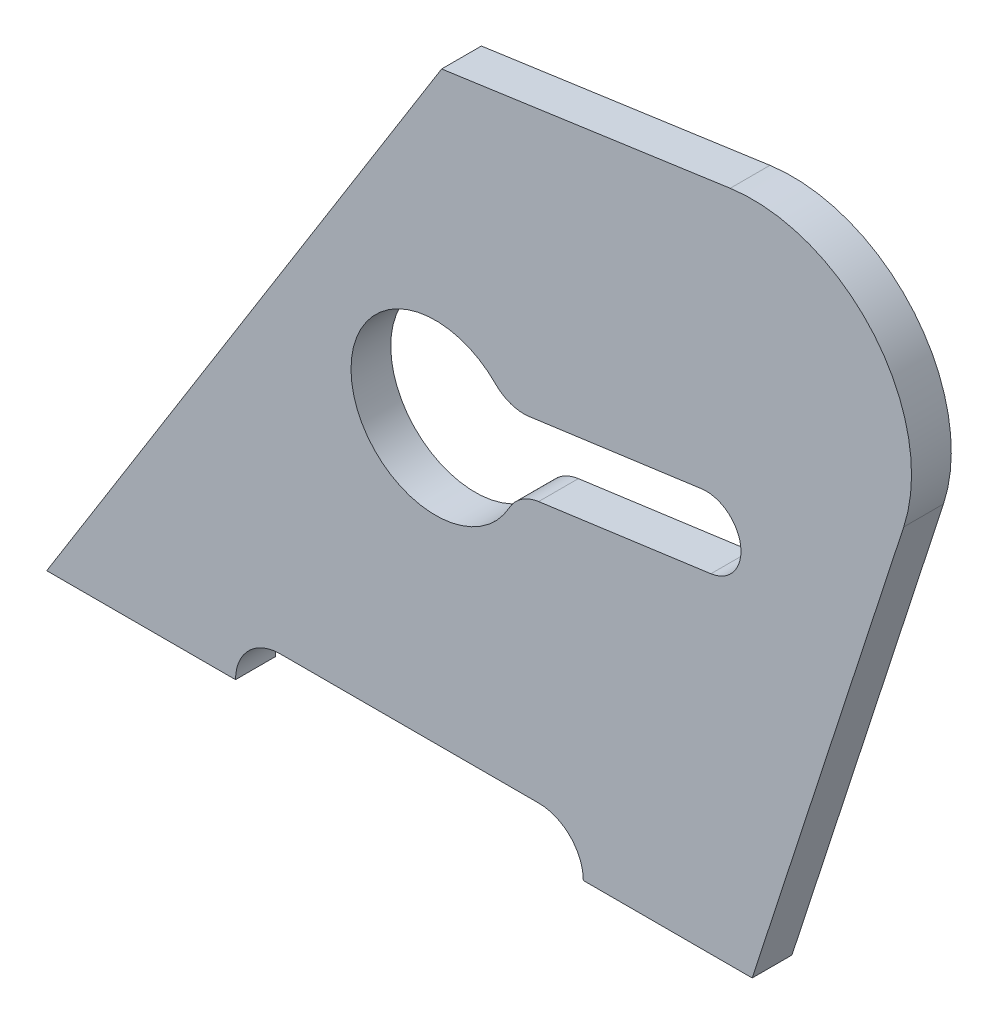
from build123d import *

# Parameters (mm, degrees)
BOSS_EXTRUDE1_DEPTH = 8


with BuildPart() as part:
    # Sketch1 → Boss-Extrude1 (new body)
    with BuildSketch(Plane.XY):
        with BuildLine():
            Line((0, 0), (79.487889635, 127.207214423))
            Line((79.487889635, 127.207214423), (137.573015724, 135.451290736))
            ThreePointArc((137.573015724, 135.451290736), (166.569139078, 124.354715336), (172.50354814, 93.880267937))
            Line((172.50354814, 93.880267937), (142, 0))
            Line((142, 0), (108, 0))
            ThreePointArc((108, 0), (105.363961031, 6.363961031), (99, 9))
            Line((99, 9), (47, 9))
            ThreePointArc((47, 9), (40.636038969, 6.363961031), (38, 0))
            Line((38, 0), (0, 0))
        make_face()
        with BuildLine():
            Line((131.785075785, 80.179945877), (97.109133521, 75.428206388))
            ThreePointArc((97.109133521, 75.428206388), (93.449886138, 75.779245046), (90.33394504, 77.729688746))
            ThreePointArc((90.33394504, 77.729688746), (61.402056741, 63.469750476), (93.103530342, 57.518568112))
            ThreePointArc((93.103530342, 57.518568112), (95.579909698, 60.235342824), (99.009829317, 61.557829483))
            Line((99.009829317, 61.557829483), (133.68577158, 66.309568971))
            ThreePointArc((133.68577158, 66.309568971), (139.670612135, 74.195105322), (131.785075785, 80.179945877))
        make_face(mode=Mode.SUBTRACT)
    extrude(amount=BOSS_EXTRUDE1_DEPTH)


solid = part.part
